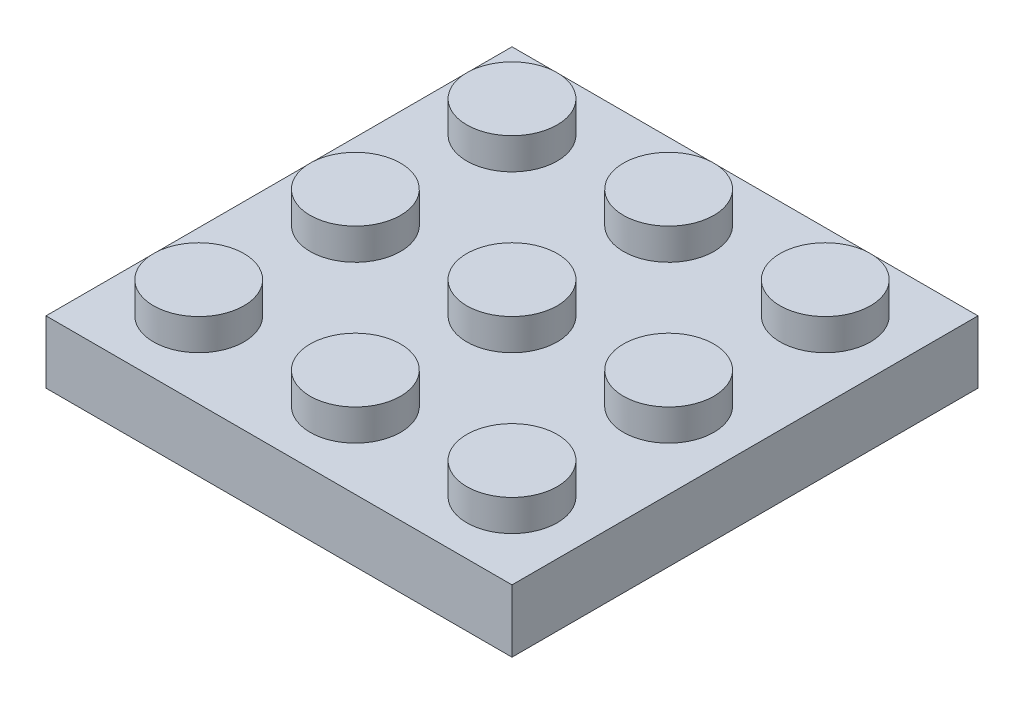
from build123d import *

# Parameters (mm, degrees)
MAINBASESKETCH_W                 = 23.8
MAINBASESKETCH_H                 = 3.2
MAINBASEEXTRUDE_DEPTH            = 11.9
STUDSSKETCH_R                    = 2.31
STUDSEXTRUDE_DEPTH               = 1.6
STUDSPATTERN_COUNT               = 3
STUDSPATTERN_PITCH               = 8
STUDSPATTERN_COUNT_DIR2          = 3
STUDSPATTERN_PITCH_DIR2          = 8
MAINBASESHELL_T                  = -1.2
TABLEBASEUNDERCIRCLES_START      = -0.2
TABLEBASEUNDERCIRCLESKETCHES_R   = 3.1
TABLEBASEUNDERCIRCLESKETCHES_R_2 = 2.4
TABLEBASEUNDERCIRCLES_DEPTH      = 2.4


with BuildPart() as part:
    # MainBaseSketch → MainBaseExtrude (new, symmetric)
    with BuildSketch(Plane.XY):
        with Locations((12.581967213, 1.6)):
            Rectangle(MAINBASESKETCH_W, MAINBASESKETCH_H)
    extrude(amount=MAINBASEEXTRUDE_DEPTH, both=True)

    # StudsSketch → StudsExtrude (add)
    with BuildSketch(Plane(origin=(0, 3.2, 0), x_dir=(1, 0, 0), z_dir=(0, 1, 0))):
        with Locations((4.581967213, 8)):
            Circle(STUDSSKETCH_R)
    studsextrude = extrude(amount=STUDSEXTRUDE_DEPTH)

    # StudsPattern: StudsExtrude 3 × 3
    with Locations(*[(j * STUDSPATTERN_PITCH_DIR2, 0, i * STUDSPATTERN_PITCH) for i in range(STUDSPATTERN_COUNT) for j in range(STUDSPATTERN_COUNT_DIR2) if (i, j) != (0, 0)]):
        add(studsextrude)

    # MainBaseShell
    mainbaseshell_openings = [part.faces().sort_by_distance(p)[0] for p in [
        (12.581967213, 0, 0),
    ]]
    offset(amount=MAINBASESHELL_T, openings=mainbaseshell_openings, kind=Kind.INTERSECTION)

    # TableBaseUnderCircleSketches → TableBaseUnderCircles (add)
    # profile 1 of 4: a face of its own
    with BuildSketch(Plane.XZ.offset(-2).offset(TABLEBASEUNDERCIRCLES_START)):
        with Locations((8.581967213, 4)):
            Circle(TABLEBASEUNDERCIRCLESKETCHES_R)
        with Locations((8.581967213, 4)):
            Circle(TABLEBASEUNDERCIRCLESKETCHES_R_2, mode=Mode.SUBTRACT)
    # profile 2 of 4: a face of its own
    with BuildSketch(Plane.XZ.offset(-2).offset(TABLEBASEUNDERCIRCLES_START)):
        with Locations(Location((16.581967213, 4, 0), (0, 0, 90))):
            Circle(TABLEBASEUNDERCIRCLESKETCHES_R)
        with Locations(Location((16.581967213, 4, 0), (0, 0, 90))):
            Circle(TABLEBASEUNDERCIRCLESKETCHES_R_2, mode=Mode.SUBTRACT)
    # profile 3 of 4: a face of its own
    with BuildSketch(Plane.XZ.offset(-2).offset(TABLEBASEUNDERCIRCLES_START)):
        with Locations(Location((8.581967213, -4, 0), (0, 0, 90))):
            Circle(TABLEBASEUNDERCIRCLESKETCHES_R)
        with Locations(Location((8.581967213, -4, 0), (0, 0, 90))):
            Circle(TABLEBASEUNDERCIRCLESKETCHES_R_2, mode=Mode.SUBTRACT)
    # profile 4 of 4: a face of its own
    with BuildSketch(Plane.XZ.offset(-2).offset(TABLEBASEUNDERCIRCLES_START)):
        with Locations(Location((16.581967213, -4, 0), (0, 0, 90))):
            Circle(TABLEBASEUNDERCIRCLESKETCHES_R)
        with Locations(Location((16.581967213, -4, 0), (0, 0, 90))):
            Circle(TABLEBASEUNDERCIRCLESKETCHES_R_2, mode=Mode.SUBTRACT)
    extrude(amount=TABLEBASEUNDERCIRCLES_DEPTH)


solid = part.part
